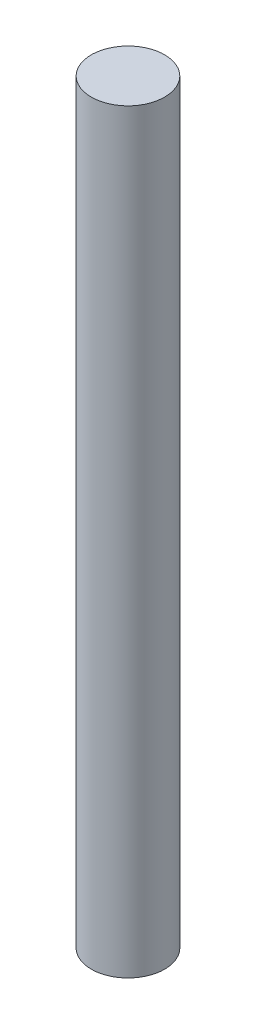
from build123d import *

# Parameters (mm, degrees)
SKETCH1_R           = 15
BOSS_EXTRUDE1_DEPTH = 309


with BuildPart() as part:
    # Sketch1 → Boss-Extrude1 (new body)
    with BuildSketch(Plane(origin=(0, 0, 0), x_dir=(1, 0, 0), z_dir=(0, 1, 0))):
        with Locations(Location((0, 0, 0), (0, 0, 270))):
            Circle(SKETCH1_R)
    extrude(amount=BOSS_EXTRUDE1_DEPTH)


solid = part.part
